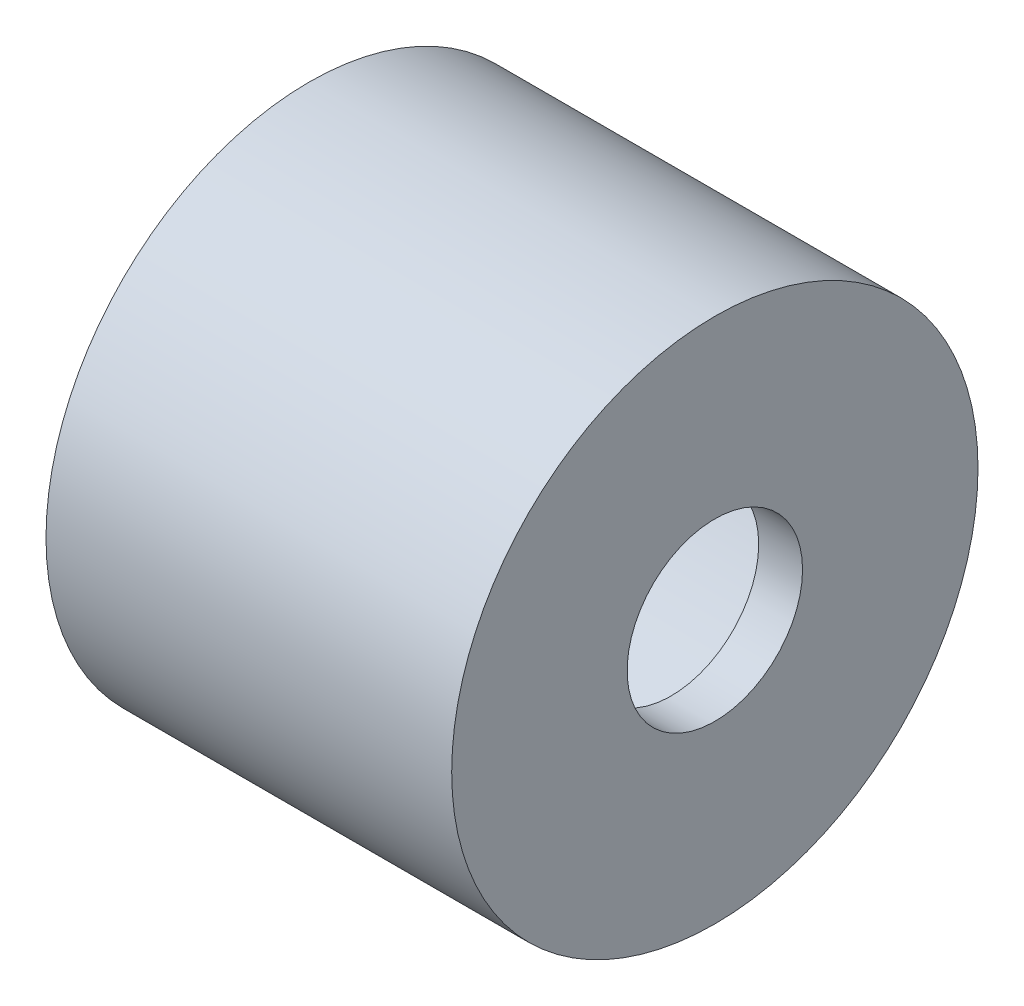
from build123d import *

# Parameters (mm, degrees)
BOSS_EXTRUDE1_START = 76.2
SKETCH2_R           = 152.4
SKETCH2_R_2         = 50.8
BOSS_EXTRUDE1_DEPTH = 25.4
BOSS_EXTRUDE2_START = 203.2
SKETCH3_R           = 152.4
SKETCH3_R_2         = 139.7
BOSS_EXTRUDE2_DEPTH = 203.2
BOSS_EXTRUDE3_START = 6.35
SKETCH4_R           = 152.4
BOSS_EXTRUDE3_DEPTH = 6.35
CUT_EXTRUDE1_START  = -120.65
CUT_EXTRUDE1_DEPTH  = 6.35


with BuildPart() as part:
    # Sketch2 → Boss-Extrude1 (new body)
    with BuildSketch(Plane(origin=(0, 0, 0), x_dir=(0, 0, -1), z_dir=(1, 0, 0)).offset(BOSS_EXTRUDE1_START)):
        Circle(SKETCH2_R)
        Circle(SKETCH2_R_2, mode=Mode.SUBTRACT)
    extrude(amount=BOSS_EXTRUDE1_DEPTH)

    # Sketch3 → Boss-Extrude2 (add)
    with BuildSketch(Plane.ZY.offset(-76.2).offset(BOSS_EXTRUDE2_START)):
        Circle(SKETCH3_R)
        Circle(SKETCH3_R_2, mode=Mode.SUBTRACT)
    extrude(amount=-BOSS_EXTRUDE2_DEPTH)

    # Sketch4 → Boss-Extrude3 (add)
    with BuildSketch(Plane.ZY.offset(127).offset(BOSS_EXTRUDE3_START)):
        Circle(SKETCH4_R)
    extrude(amount=-BOSS_EXTRUDE3_DEPTH)

    # Sketch5 → Cut-Extrude1 (cut)
    with BuildSketch(Plane.ZY.offset(254).offset(CUT_EXTRUDE1_START)):
        with BuildLine():
            Line((19.05, 88.9), (19.05, -88.9))
            ThreePointArc((19.05, -88.9), (-6.35, -114.3), (-31.75, -88.9))
            Line((-31.75, -88.9), (-31.75, 88.9))
            ThreePointArc((-31.75, 88.9), (-6.35, 114.3), (19.05, 88.9))
        make_face()
    extrude(amount=-CUT_EXTRUDE1_DEPTH, mode=Mode.SUBTRACT)


solid = part.part
